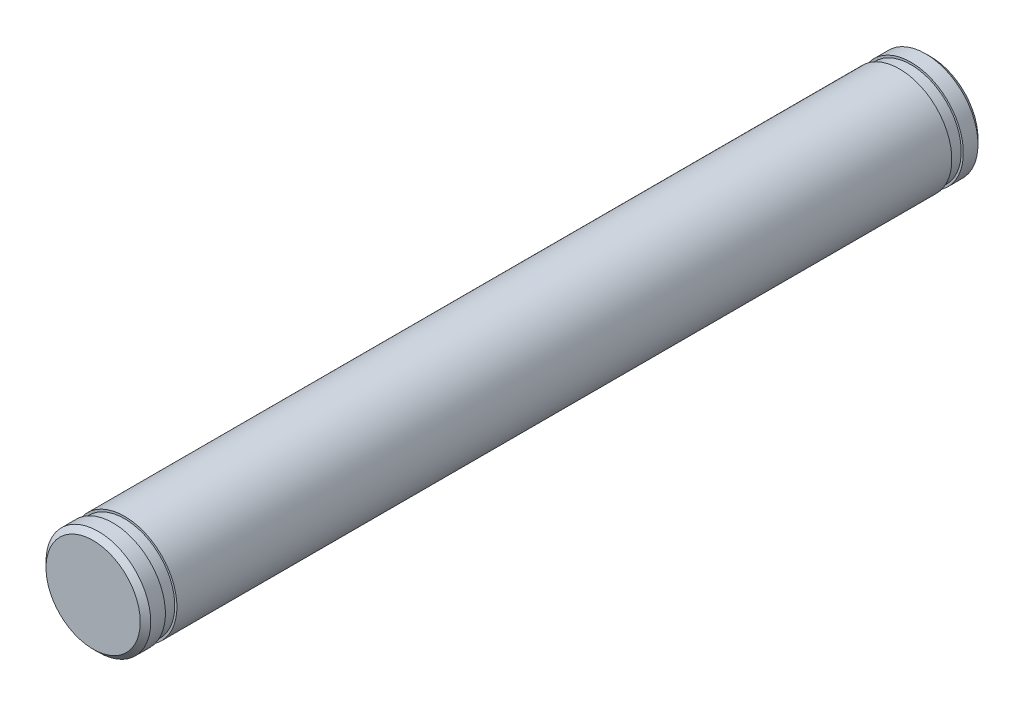
from build123d import *

# Parameters (mm, degrees)
SKETCH_1_R          = 5
EXTRUDE_1_DEPTH     = 80
CHAMFER_1_SIZE      = 0.5
CUT_EXTRUDE_START   = -1.9
SKETCH_2_R          = 5
SKETCH_2_R_2        = 4.8
CUT_EXTRUDE_1_DEPTH = 1.1


with BuildPart() as part:
    # 草图1 → 凸台-拉伸1 (new body)
    with BuildSketch(Plane.XY):
        Circle(SKETCH_1_R)
    extrude(amount=EXTRUDE_1_DEPTH)

    # 倒角1
    chamfer_1_edges = [part.edges().sort_by_distance(p)[0] for p in [
        (-5, 0, 0),
        (-5, 0, 80),
    ]]
    chamfer(chamfer_1_edges, length=CHAMFER_1_SIZE)

    # 草图2 → 切除-拉伸1 (cut)
    with BuildSketch(Plane(origin=(0, 0, 0), x_dir=(-1, 0, 0), z_dir=(0, 0, -1)).offset(CUT_EXTRUDE_START)):
        Circle(SKETCH_2_R)
        Circle(SKETCH_2_R_2, mode=Mode.SUBTRACT)
    cut_extrude_1 = extrude(amount=-CUT_EXTRUDE_1_DEPTH, mode=Mode.SUBTRACT)

    # 镜向1: 切除-拉伸1 across plane
    add(cut_extrude_1.mirror(Plane.XY.offset(40)), mode=Mode.SUBTRACT)


solid = part.part
